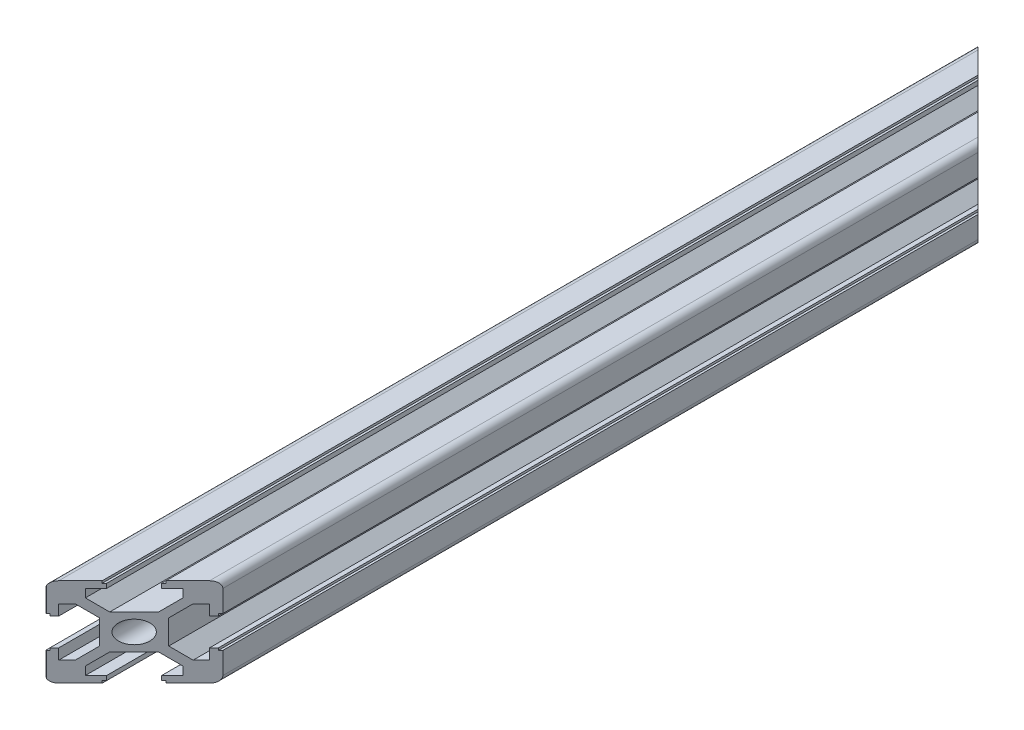
from build123d import *

# Parameters (mm, degrees)
SKETCH1_R           = 2.5
EXTRUDE_1_DEPTH     = 210
CUT_EXTRUDE_1_DEPTH = 212.187120819


with BuildPart() as part:
    # Sketch1 → 凸台-拉伸1 (new body)
    with BuildSketch(Plane.XY):
        with BuildLine():
            Line((-3.6, 10), (-3.6, 9.5))
            Line((-3.6, 9.5), (-3.1, 9.5))
            Line((-3.1, 9.5), (-3.1, 8.5))
            Line((-3.1, 8.5), (-5.5, 8.5))
            Line((-5.5, 8.5), (-5.5, 6.65))
            Line((-5.5, 6.65), (-2.75, 3.9))
            Line((-2.75, 3.9), (2.75, 3.9))
            Line((2.75, 3.9), (5.5, 6.65))
            Line((5.5, 6.65), (5.5, 8.5))
            Line((5.5, 8.5), (3.1, 8.5))
            Line((3.1, 8.5), (3.1, 9.5))
            Line((3.1, 9.5), (3.6, 9.5))
            Line((3.6, 9.5), (3.6, 10))
            Line((3.6, 10), (8.5, 10))
            ThreePointArc((8.5, 10), (9.560660172, 9.560660172), (10, 8.5))
            Line((10, 8.5), (10, 3.6))
            Line((10, 3.6), (9.5, 3.6))
            Line((9.5, 3.6), (9.5, 3.1))
            Line((9.5, 3.1), (8.5, 3.1))
            Line((8.5, 3.1), (8.5, 5.5))
            Line((8.5, 5.5), (6.65, 5.5))
            Line((6.65, 5.5), (3.9, 2.75))
            Line((3.9, 2.75), (3.9, -2.75))
            Line((3.9, -2.75), (6.65, -5.5))
            Line((6.65, -5.5), (8.5, -5.5))
            Line((8.5, -5.5), (8.5, -3.1))
            Line((8.5, -3.1), (9.5, -3.1))
            Line((9.5, -3.1), (9.5, -3.6))
            Line((9.5, -3.6), (10, -3.6))
            Line((10, -3.6), (10, -8.5))
            ThreePointArc((10, -8.5), (9.560660172, -9.560660172), (8.5, -10))
            Line((8.5, -10), (3.6, -10))
            Line((3.6, -10), (3.6, -9.5))
            Line((3.6, -9.5), (3.1, -9.5))
            Line((3.1, -9.5), (3.1, -8.5))
            Line((3.1, -8.5), (5.5, -8.5))
            Line((5.5, -8.5), (5.5, -6.65))
            Line((5.5, -6.65), (2.75, -3.9))
            Line((2.75, -3.9), (-2.75, -3.9))
            Line((-2.75, -3.9), (-5.5, -6.65))
            Line((-5.5, -6.65), (-5.5, -8.5))
            Line((-5.5, -8.5), (-3.1, -8.5))
            Line((-3.1, -8.5), (-3.1, -9.5))
            Line((-3.1, -9.5), (-3.6, -9.5))
            Line((-3.6, -9.5), (-3.6, -10))
            Line((-3.6, -10), (-8.5, -10))
            ThreePointArc((-8.5, -10), (-9.560660172, -9.560660172), (-10, -8.5))
            Line((-10, -8.5), (-10, -3.6))
            Line((-10, -3.6), (-9.5, -3.6))
            Line((-9.5, -3.6), (-9.5, -3.1))
            Line((-9.5, -3.1), (-8.5, -3.1))
            Line((-8.5, -3.1), (-8.5, -5.5))
            Line((-8.5, -5.5), (-6.65, -5.5))
            Line((-6.65, -5.5), (-3.9, -2.75))
            Line((-3.9, -2.75), (-3.9, 2.75))
            Line((-3.9, 2.75), (-6.65, 5.5))
            Line((-6.65, 5.5), (-8.5, 5.5))
            Line((-8.5, 5.5), (-8.5, 3.1))
            Line((-8.5, 3.1), (-9.5, 3.1))
            Line((-9.5, 3.1), (-9.5, 3.6))
            Line((-9.5, 3.6), (-10, 3.6))
            Line((-10, 3.6), (-10, 8.5))
            ThreePointArc((-10, 8.5), (-9.560660172, 9.560660172), (-8.5, 10))
            Line((-8.5, 10), (-3.6, 10))
        make_face()
        Circle(SKETCH1_R, mode=Mode.SUBTRACT)
    extrude(amount=EXTRUDE_1_DEPTH)

    # 草图1 → 切除-拉伸1 (cut, through all)
    with BuildSketch(Plane(origin=(0, 10, 0), x_dir=(1, 0, 0), z_dir=(0, 1, 0))):
        Polygon((-9.86868981, -210), (10.13131019, -210), (10.13131019, -190), align=None)
        Polygon((-9.910928713, 0), (10.089071287, 0), (10.089071287, -20), align=None)
    extrude(amount=-CUT_EXTRUDE_1_DEPTH, mode=Mode.SUBTRACT)


solid = part.part
